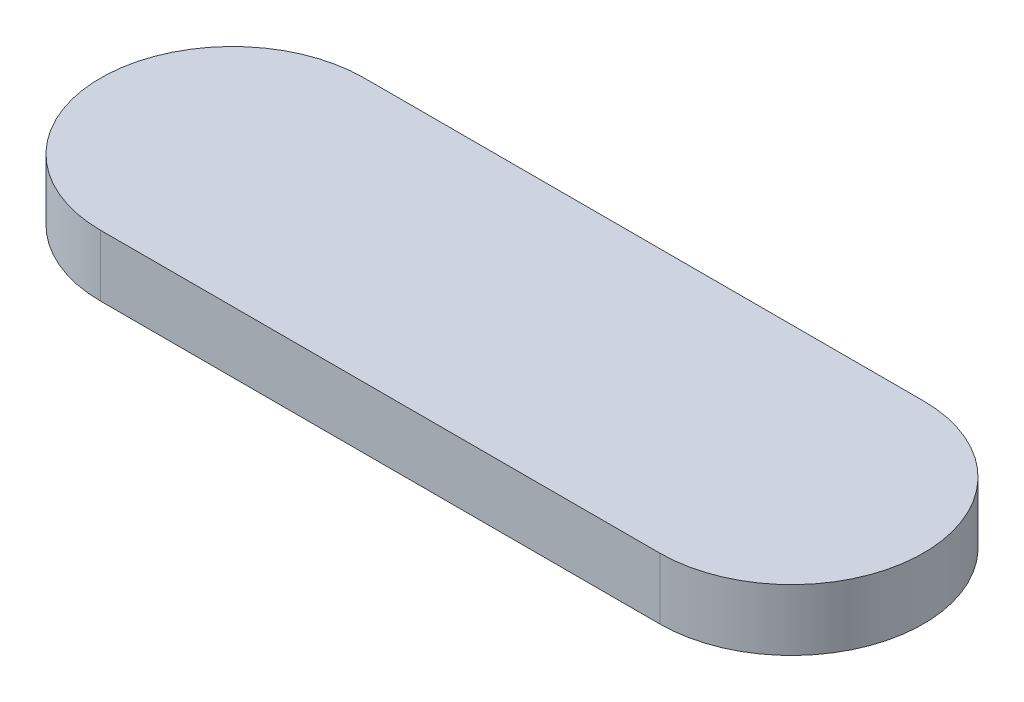
from build123d import *

# Parameters (mm, degrees)
EXTRUDE_1_DEPTH = 2.7


with BuildPart() as part:
    # 草图1 → 凸台-拉伸1 (new body)
    with BuildSketch(Plane(origin=(0, 0, 0), x_dir=(1, 0, 0), z_dir=(0, 1, 0))):
        with BuildLine():
            Line((-11.20758513, 2.97886472), (13.39241487, 2.97886472))
            ThreePointArc((13.39241487, 2.97886472), (19.19241487, -2.82113528), (13.39241487, -8.62113528))
            Line((13.39241487, -8.62113528), (-11.20758513, -8.62113528))
            ThreePointArc((-11.20758513, -8.62113528), (-17.00758513, -2.82113528), (-11.20758513, 2.97886472))
        make_face()
    extrude(amount=EXTRUDE_1_DEPTH)


solid = part.part
